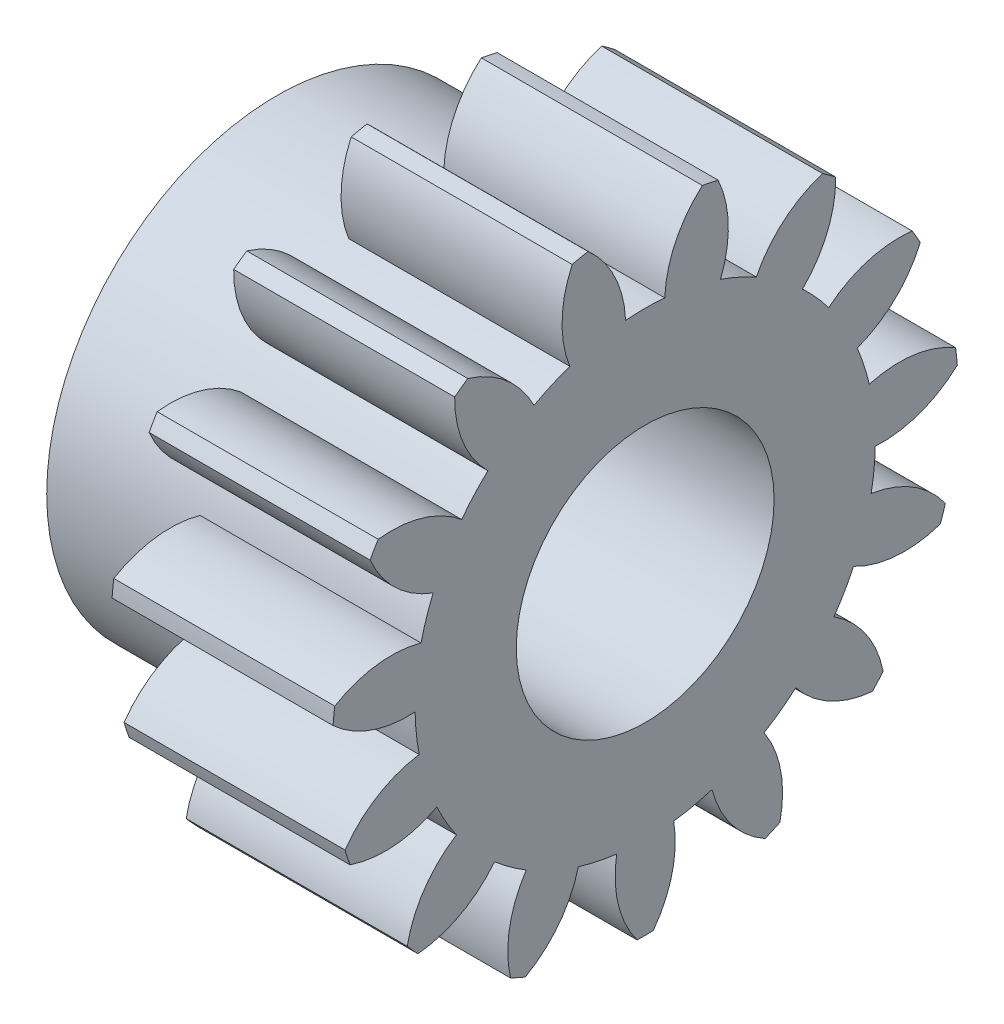
from build123d import *
from build123d.topology import SkipClean

# Parameters (mm, degrees)
BASPROSKE_W      = 3
BASPROSKE_H      = 4.25
TOOTHCUT_DEPTH   = 7.717514421
TEETHCUTS_COUNT  = 15
TEETHCUTS_ANGLE  = 336
HUBNEARONE_START = 2.0000508
HUBNEAONESKE_R   = 3.124
HUBNEARONE_DEPTH = 2.0000508
BORSKE_R         = 1.75
BORE_DEPTH       = 5.0000508


with BuildPart() as part:
    # BasProSke → Base-Revolve (revolve)
    with BuildSketch(Plane(origin=(0, 0, 0), x_dir=(1, 0, 0), z_dir=(0, 1, 0)), mode=Mode.PRIVATE) as base_revolve_sk:
        with Locations((1.5, 2.125)):
            Rectangle(BASPROSKE_W, BASPROSKE_H)
    revolve(base_revolve_sk.sketch.rotate(Axis((-10, 0, 0), (1, 0, 0)), 180), axis=Axis((-10, 0, 0), (1, 0, 0)))

    # TooCutSke → ToothCut (cut, through all)
    with BuildSketch(Plane(origin=(0, 0, 0), x_dir=(0, 0, -1), z_dir=(1, 0, 0))):
        with BuildLine():
            ThreePointArc((0.265767165, 3.112674704), (0, 3.124), (-0.265767165, 3.112674704))
            ThreePointArc((-0.265767165, 3.112674704), (-0.418628877, 3.712626775), (-0.800767345, 4.19974009))
            ThreePointArc((-0.800767345, 4.19974009), (0, 4.2754), (0.800767345, 4.19974009))
            ThreePointArc((0.800767345, 4.19974009), (0.418628877, 3.712626775), (0.265767165, 3.112674704))
        make_face()
    toothcut = extrude(amount=TOOTHCUT_DEPTH, mode=Mode.SUBTRACT)

    # TeethCuts: ToothCut ×15 about axis
    teethcuts_axis = Axis((-10, 0, 0), (1, 0, 0))
    for i in range(1, TEETHCUTS_COUNT):
        add(toothcut.rotate(teethcuts_axis, i * TEETHCUTS_ANGLE / (TEETHCUTS_COUNT - 1)), mode=Mode.SUBTRACT)

    # HubNeaOneSke → HubNearOne (add)
    with SkipClean():  # the faces are left unmerged after this step: merging them gives an invalid solid
        with BuildSketch(Plane.ZY.offset(HUBNEARONE_START)):
            Circle(HUBNEAONESKE_R)
        extrude(amount=-HUBNEARONE_DEPTH)

    # BorSke → Bore (cut, symmetric)
    with SkipClean():  # the faces are left unmerged after this step: merging them gives an invalid solid
        with BuildSketch(Plane(origin=(0, 0, 0), x_dir=(0, 0, -1), z_dir=(1, 0, 0))):
            with Locations(Location((0, 0, 0), (0, 0, 180))):
                Circle(BORSKE_R)
        extrude(amount=BORE_DEPTH, both=True, mode=Mode.SUBTRACT)


solid = part.part
